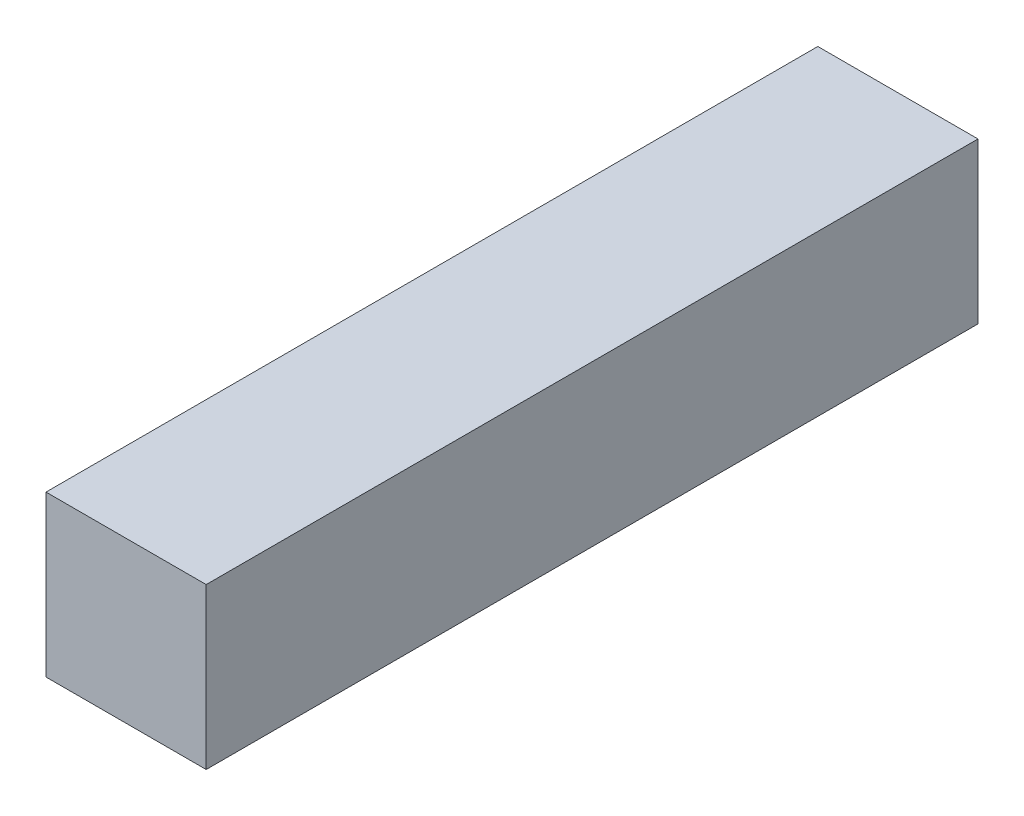
from build123d import *

# Parameters (mm, degrees)
SKETCH1_W           = 22
SKETCH1_H           = 22
BOSS_EXTRUDE1_DEPTH = 106


with BuildPart() as part:
    # Sketch1 → Boss-Extrude1 (new body)
    with BuildSketch(Plane.XY):
        Rectangle(SKETCH1_W, SKETCH1_H)
    extrude(amount=BOSS_EXTRUDE1_DEPTH)


solid = part.part
